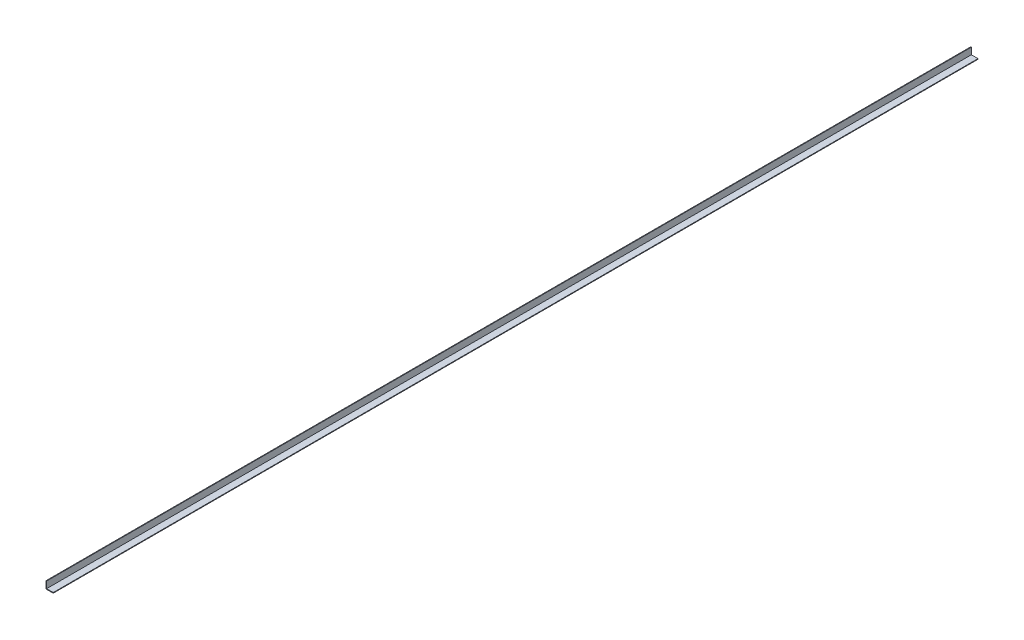
from build123d import *

# Parameters (mm, degrees)
BOSS_EXTRUDE1_DEPTH = 2438.4


with BuildPart() as part:
    # Sketch2 → Boss-Extrude1 (new body)
    with BuildSketch(Plane.XY):
        Polygon((0, -9.525), (0, 9.525), (1.5875, 9.525), (1.5875, -7.9375), (19.05, -7.9375), (19.05, -9.525), align=None)
    extrude(amount=BOSS_EXTRUDE1_DEPTH)


solid = part.part
